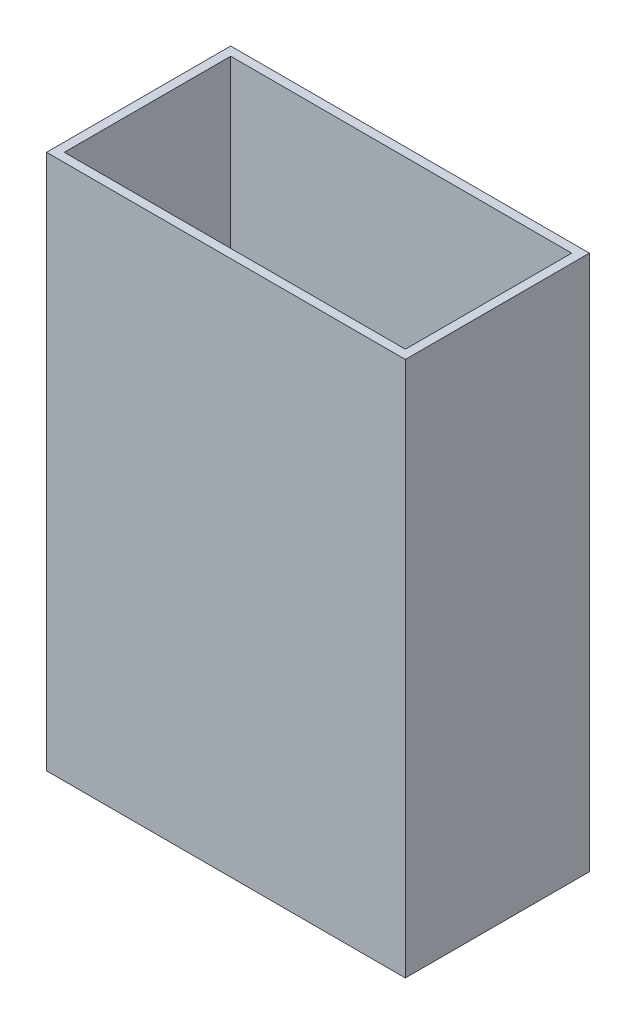
from build123d import *

# Parameters (mm, degrees)
SKETCH_1_W      = 64.7
SKETCH_1_H      = 33.2
EXTRUDE_1_DEPTH = 1.6
SKETCH_2_W      = 64.7
SKETCH_2_H      = 33.2
SKETCH_2_W_2    = 61.5
SKETCH_2_H_2    = 30
EXTRUDE_2_DEPTH = 95
SKETCH_4_W      = 1.6
SKETCH_4_H      = 1.6
EXTRUDE_3_DEPTH = 60


with BuildPart() as part:
    # Эскиз1 → Бобышка-Вытянуть1 (new body)
    with BuildSketch(Plane(origin=(0, 0, 0), x_dir=(1, 0, 0), z_dir=(0, 1, 0))):
        Rectangle(SKETCH_1_W, SKETCH_1_H)
    extrude(amount=EXTRUDE_1_DEPTH)

    # Эскиз2 → Бобышка-Вытянуть2 (add)
    with BuildSketch(Plane(origin=(0, 1.6, 0), x_dir=(1, 0, 0), z_dir=(0, 1, 0))):
        Rectangle(SKETCH_2_W, SKETCH_2_H)
        Rectangle(SKETCH_2_W_2, SKETCH_2_H_2, mode=Mode.SUBTRACT)
    extrude(amount=EXTRUDE_2_DEPTH)

    # Эскиз4 → Бобышка-Вытянуть3 (add)
    with BuildSketch(Plane(origin=(0, 1.6, 0), x_dir=(1, 0, 0), z_dir=(0, 1, 0))):
        with Locations((-29.95, 2.2)):
            Rectangle(SKETCH_4_W, SKETCH_4_H)
        with Locations((29.95, -1.4)):
            Rectangle(SKETCH_4_W, SKETCH_4_H)
        with Locations((-29.95, -1.4)):
            Rectangle(SKETCH_4_W, SKETCH_4_H)
        with Locations((29.95, 2.2)):
            Rectangle(SKETCH_4_W, SKETCH_4_H)
    extrude(amount=EXTRUDE_3_DEPTH)


solid = part.part
